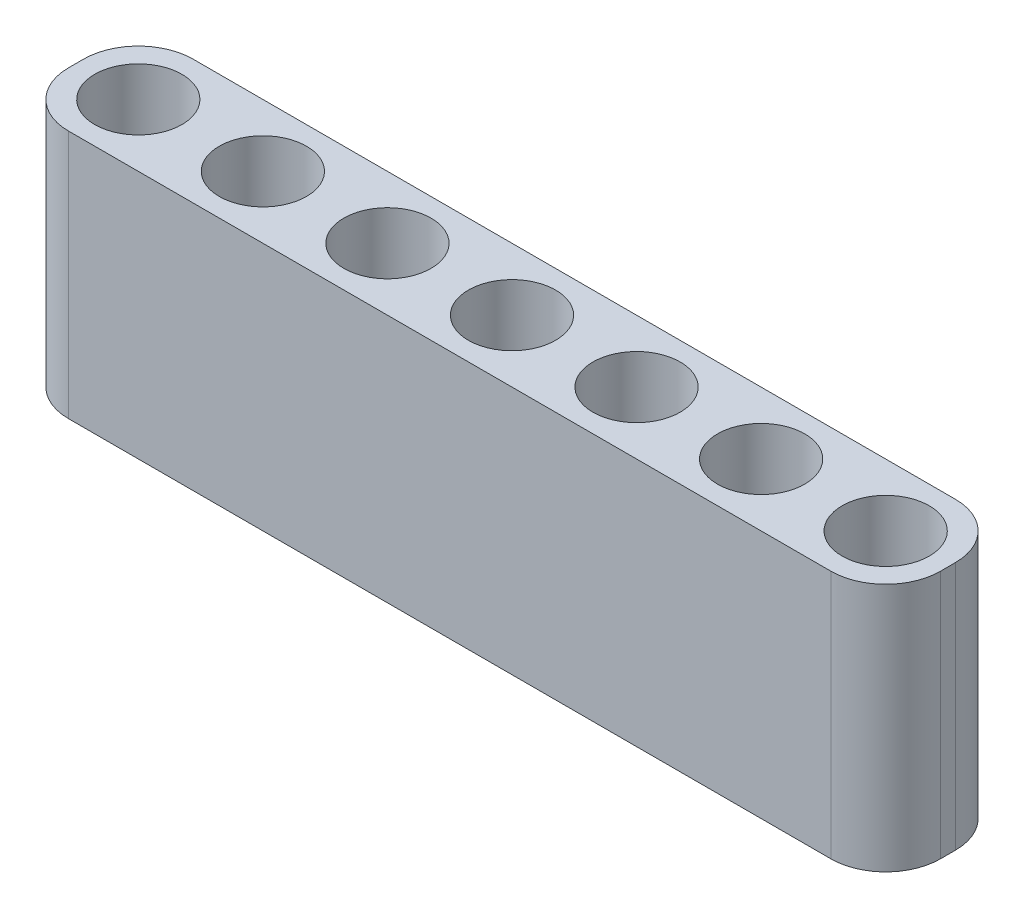
from build123d import *

# Parameters (mm, degrees)
SKETCH1_R           = 1.75
BOSS_EXTRUDE1_DEPTH = 10


with BuildPart() as part:
    # Sketch1 → Boss-Extrude1 (new body)
    with BuildSketch(Plane(origin=(0, 0, 0), x_dir=(1, 0, 0), z_dir=(0, 1, 0))):
        with BuildLine():
            Line((2.2, 0), (32.8, 0))
            ThreePointArc((32.8, 0), (34.355634919, 0.644365081), (35, 2.2))
            Line((35, 2.2), (35, 2.8))
            ThreePointArc((35, 2.8), (34.355634919, 4.355634919), (32.8, 5))
            Line((32.8, 5), (2.2, 5))
            ThreePointArc((2.2, 5), (0.644365081, 4.355634919), (0, 2.8))
            Line((0, 2.8), (0, 2.2))
            ThreePointArc((0, 2.2), (0.644365081, 0.644365081), (2.2, 0))
        make_face()
        with Locations(Location((2.5, 2.5, 0), (0, 0, 270))):
            Circle(SKETCH1_R, mode=Mode.SUBTRACT)
        with Locations(Location((7.5, 2.5, 0), (0, 0, 270))):
            Circle(SKETCH1_R, mode=Mode.SUBTRACT)
        with Locations(Location((12.5, 2.5, 0), (0, 0, 270))):
            Circle(SKETCH1_R, mode=Mode.SUBTRACT)
        with Locations(Location((17.5, 2.5, 0), (0, 0, 270))):
            Circle(SKETCH1_R, mode=Mode.SUBTRACT)
        with Locations(Location((22.5, 2.5, 0), (0, 0, 270))):
            Circle(SKETCH1_R, mode=Mode.SUBTRACT)
        with Locations(Location((27.5, 2.5, 0), (0, 0, 270))):
            Circle(SKETCH1_R, mode=Mode.SUBTRACT)
        with Locations(Location((32.5, 2.5, 0), (0, 0, 270))):
            Circle(SKETCH1_R, mode=Mode.SUBTRACT)
    extrude(amount=BOSS_EXTRUDE1_DEPTH)


solid = part.part
